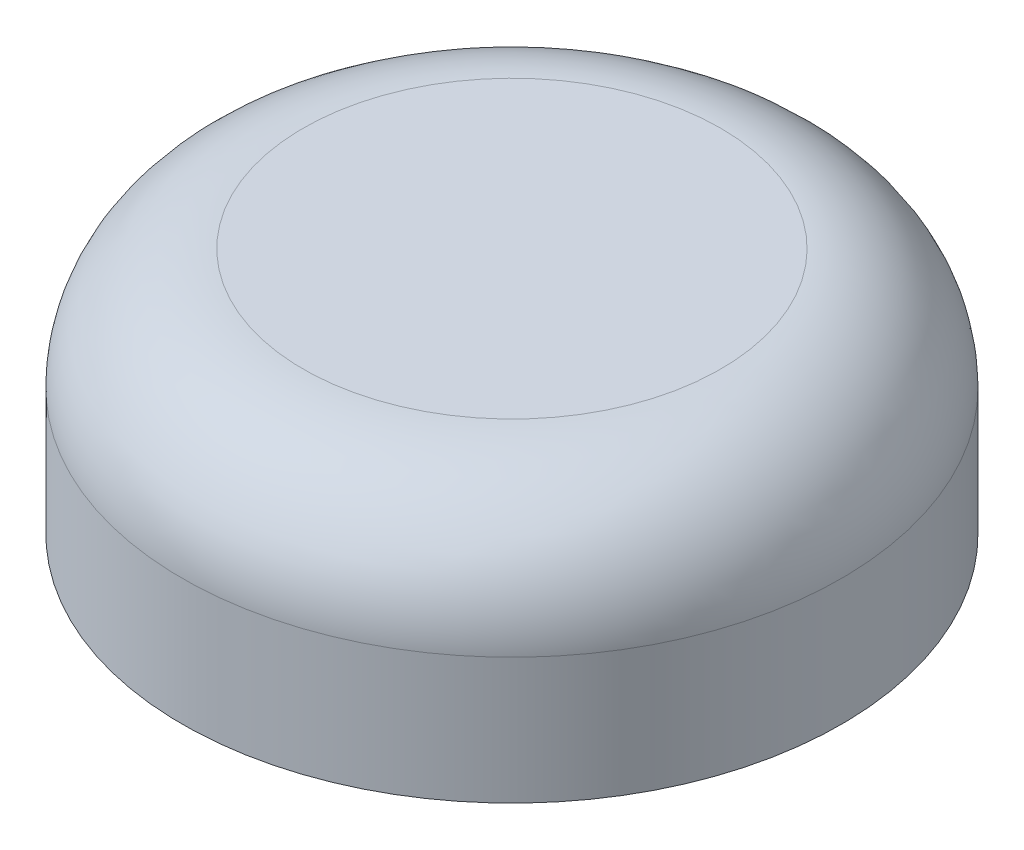
from build123d import *


with BuildPart() as part:
    # Sketch1 → Revolve1 (revolve)
    with BuildSketch(Plane.XY, mode=Mode.PRIVATE) as revolve1_sk:
        with BuildLine():
            Line((0, 0), (-24.13, 0))
            ThreePointArc((-24.13, 0), (-30.416179285, -2.603820715), (-33.02, -8.89))
            Line((-33.02, -8.89), (-33.02, -10.795))
            Line((-33.02, -10.795), (-35.56, -10.795))
            Line((-35.56, -10.795), (-35.56, -23.495))
            Line((-35.56, -23.495), (-38.1, -23.495))
            Line((-38.1, -23.495), (-38.1, -8.89))
            ThreePointArc((-38.1, -8.89), (-34.008281733, 0.988281733), (-24.13, 5.08))
            Line((-24.13, 5.08), (0, 5.08))
            Line((0, 5.08), (0, 0))
        make_face()
    revolve(revolve1_sk.sketch.rotate(Axis((0, 0, 0), (0, 1, 0)), 270), axis=Axis((0, 0, 0), (0, 1, 0)))


solid = part.part
